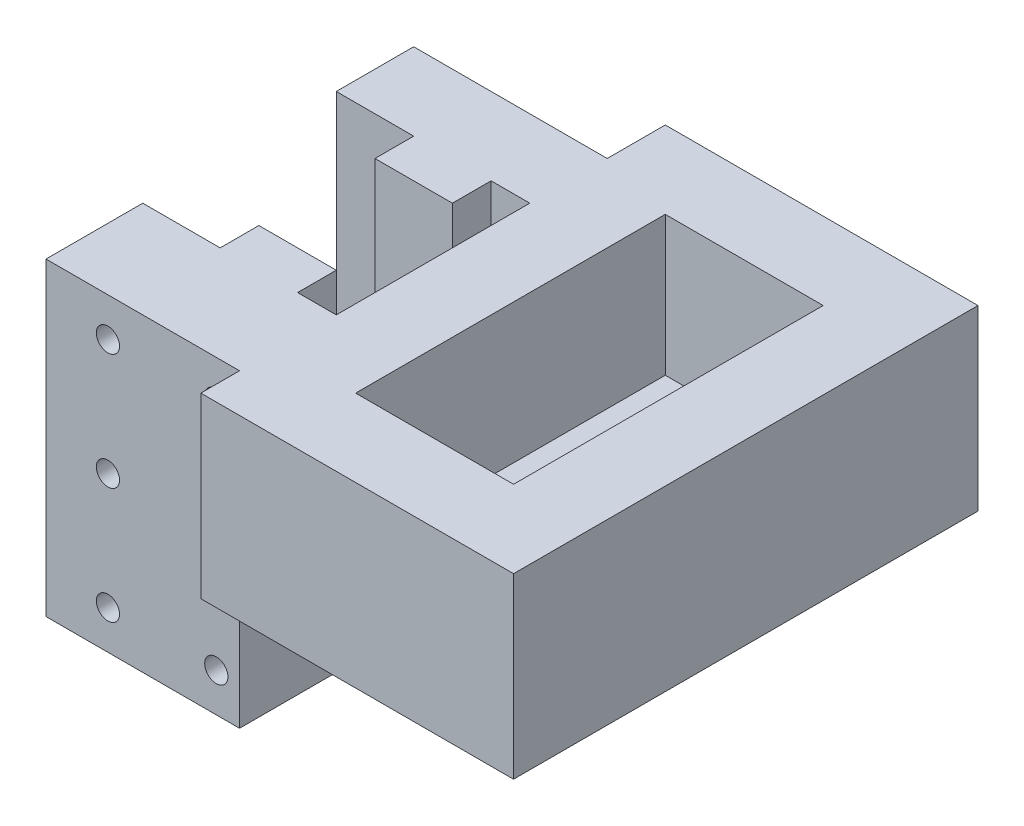
from build123d import *

# Parameters (mm, degrees)
SKETCH1_W           = 40.4
SKETCH1_H           = 60
SKETCH1_W_2         = 20.4
SKETCH1_H_2         = 40
BOSS_EXTRUDE1_DEPTH = 18
SKETCH2_W           = 40.4
SKETCH2_H           = 60
BOSS_EXTRUDE2_DEPTH = 5
BOSS_EXTRUDE3_DEPTH = 40
SKETCH5_W           = 25
SKETCH5_H           = 40
SKETCH5_R           = 1.5
BOSS_EXTRUDE4_DEPTH = 2.5


with BuildPart() as part:
    # Sketch1 → Boss-Extrude1 (new body)
    with BuildSketch(Plane(origin=(0, 0, 0), x_dir=(1, 0, 0), z_dir=(0, 1, 0))):
        Rectangle(SKETCH1_W, SKETCH1_H)
        Rectangle(SKETCH1_W_2, SKETCH1_H_2, mode=Mode.SUBTRACT)
    extrude(amount=BOSS_EXTRUDE1_DEPTH)

    # Sketch2 → Boss-Extrude2 (add)
    with BuildSketch(Plane.XZ):
        Rectangle(SKETCH2_W, SKETCH2_H)
    extrude(amount=BOSS_EXTRUDE2_DEPTH)

    # Sketch4 → Boss-Extrude3 (add)
    with BuildSketch(Plane(origin=(0, 18, 0), x_dir=(1, 0, 0), z_dir=(0, 1, 0))):
        Polygon((-20.2, 22.5), (-45.2, 22.5), (-45.2, 12.5), (-35.2, 12.5), (-35.2, 7.5), (-25.2, 7.5), (-25.2, 12.5), (-20.2, 12.5), align=None)
        Polygon((-20.2, -12.5), (-20.2, -22.5), (-45.2, -22.5), (-45.2, -12.5), (-35.2, -12.5), (-35.2, -7.5), (-25.2, -7.5), (-25.2, -12.5), align=None)
    extrude(amount=-BOSS_EXTRUDE3_DEPTH)

    # Sketch5 → Boss-Extrude4 (add)
    with BuildSketch(Plane.XY.offset(22.5)):
        with Locations((-32.7, -2)):
            Rectangle(SKETCH5_W, SKETCH5_H)
        with Locations((-37.2, 13)):
            Circle(SKETCH5_R, mode=Mode.SUBTRACT)
        with Locations((-23.2, 13)):
            Circle(SKETCH5_R, mode=Mode.SUBTRACT)
        with Locations((-37.2, -2)):
            Circle(SKETCH5_R, mode=Mode.SUBTRACT)
        with Locations((-23.2, -2)):
            Circle(SKETCH5_R, mode=Mode.SUBTRACT)
        with Locations((-37.2, -17)):
            Circle(SKETCH5_R, mode=Mode.SUBTRACT)
        with Locations((-23.2, -17)):
            Circle(SKETCH5_R, mode=Mode.SUBTRACT)
    extrude(amount=BOSS_EXTRUDE4_DEPTH)


solid = part.part
